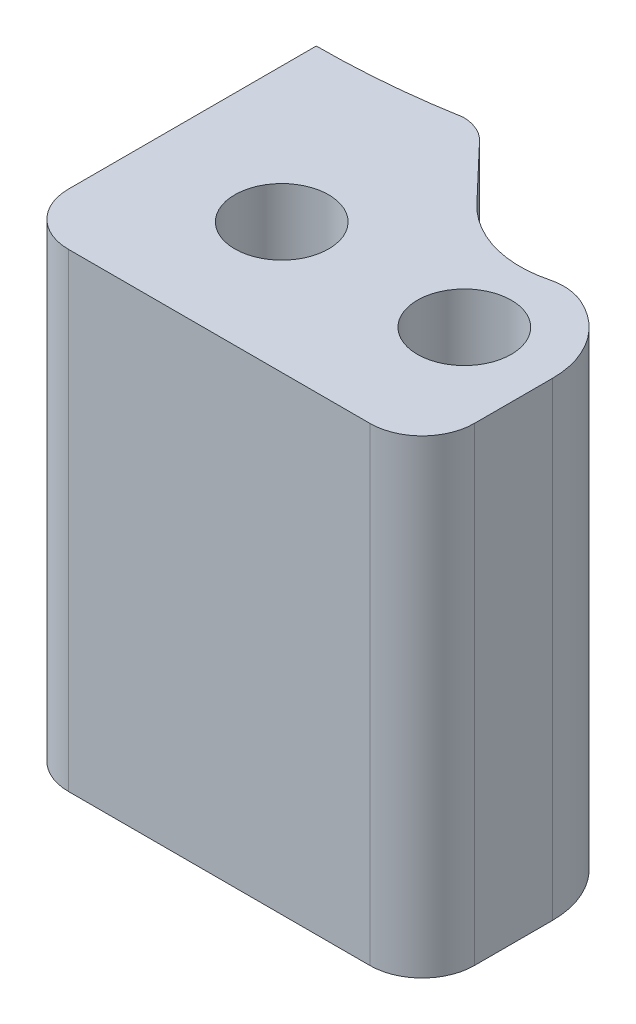
from build123d import *

# Parameters (mm, degrees)
SKETCH_1_R      = 1.8
EXTRUDE_1_DEPTH = 18
FILLET_1_R      = 2


with BuildPart() as part:
    # 草图1 → 凸台-拉伸1 (new body)
    with BuildSketch(Plane(origin=(0, 0, 0), x_dir=(1, 0, 0), z_dir=(0, 1, 0))):
        with BuildLine():
            Line((0, -41.32), (0, -31.32))
            Line((0, -31.32), (0, -29.82))
            ThreePointArc((0, -29.82), (2.597888216, -29.706621767), (5.176021638, -29.367349216))
            ThreePointArc((5.176021638, -29.367349216), (5.775398606, -29.490339394), (6.277905634, -29.839432535))
            Line((6.277905634, -29.839432535), (8.333639143, -31.996940996))
            ThreePointArc((8.333639143, -31.996940996), (10.127846327, -33.082932859), (12.22492131, -33.111816408))
            ThreePointArc((12.22492131, -33.111816408), (12.877077837, -33.05487755), (13.512685008, -33.211573734))
            ThreePointArc((13.512685008, -33.211573734), (15.001951856, -34.459059049), (15.559656196, -36.32))
            Line((15.559656196, -36.32), (15.559656196, -41.32))
            Line((15.559656196, -41.32), (0, -41.32))
        make_face()
        with Locations(Location((5.176021638, -36.32, 0), (0, 0, 270))):
            Circle(SKETCH_1_R, mode=Mode.SUBTRACT)
        with Locations(Location((12.176021638, -36.32, 0), (0, 0, 270))):
            Circle(SKETCH_1_R, mode=Mode.SUBTRACT)
    extrude(amount=EXTRUDE_1_DEPTH)

    # 圆角1
    fillet_1_edges = [part.edges().sort_by_distance(p)[0] for p in [
        (15.559656196, 9, 41.32),
        (0, 9, 41.32),
    ]]
    fillet(fillet_1_edges, radius=FILLET_1_R)


solid = part.part
